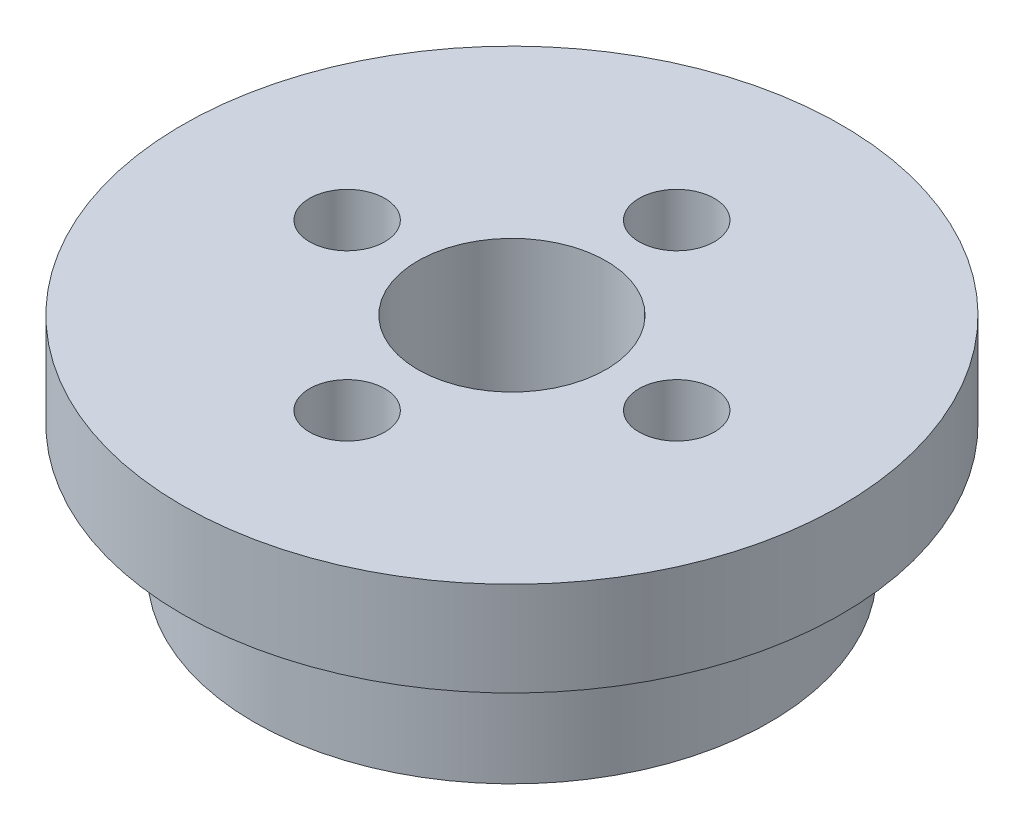
from build123d import *

# Parameters (mm, degrees)
SKETCH_3_R          = 10.95
EXTRUDE_1_DEPTH     = 5.5
SKETCH_4_R          = 14
EXTRUDE_2_DEPTH     = 4
SKETCH_5_R          = 4
SKETCH_5_R_2        = 1.6
CUT_EXTRUDE_1_DEPTH = 50


with BuildPart() as part:
    # 草图3 → 凸台-拉伸1 (new body)
    with BuildSketch(Plane(origin=(0, 0, 0), x_dir=(1, 0, 0), z_dir=(0, 1, 0))):
        with Locations(Location((0, 0, 0), (0, 0, 270))):
            Circle(SKETCH_3_R)
    extrude(amount=EXTRUDE_1_DEPTH)

    # 草图4 → 凸台-拉伸2 (add)
    with BuildSketch(Plane(origin=(0, 5.5, 0), x_dir=(1, 0, 0), z_dir=(0, 1, 0))):
        with Locations(Location((0, 0, 0), (0, 0, 270))):
            Circle(SKETCH_4_R)
    extrude(amount=EXTRUDE_2_DEPTH)

    # 草图5 → 切除-拉伸1 (cut)
    with BuildSketch(Plane(origin=(0, 9.5, 0), x_dir=(1, 0, 0), z_dir=(0, 1, 0))):
        with Locations(Location((0, 0, 0), (0, 0, 270))):
            Circle(SKETCH_5_R)
        with Locations(Location((0, 7, 0), (0, 0, 270))):
            Circle(SKETCH_5_R_2)
        with Locations(Location((7, 0, 0), (0, 0, 270))):
            Circle(SKETCH_5_R_2)
        with Locations(Location((0, -7, 0), (0, 0, 270))):
            Circle(SKETCH_5_R_2)
        with Locations(Location((-7, 0, 0), (0, 0, 270))):
            Circle(SKETCH_5_R_2)
    extrude(amount=-CUT_EXTRUDE_1_DEPTH, mode=Mode.SUBTRACT)


solid = part.part
